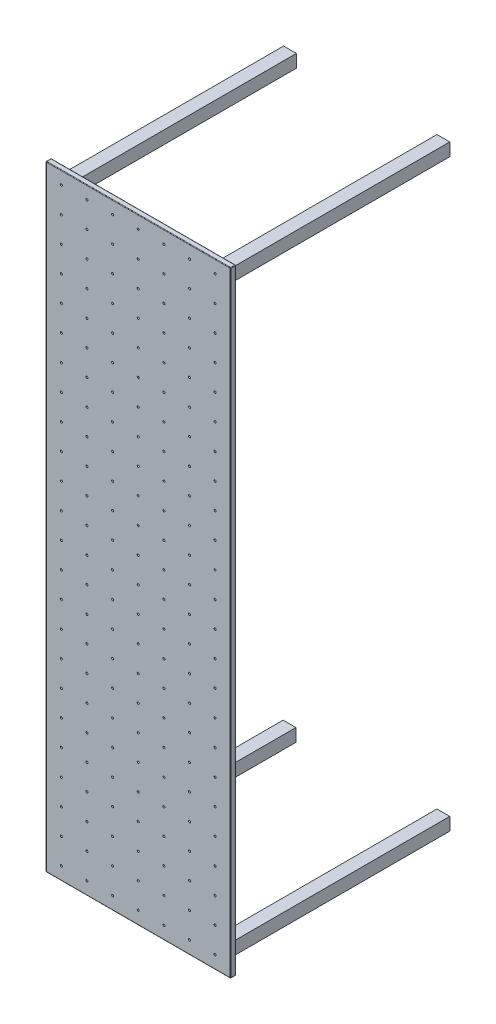
from build123d import *

# Parameters (mm, degrees)
SKETCH1_W           = 720
SKETCH1_H           = 2400
BOSS_EXTRUDE1_DEPTH = 20
SKETCH2_R           = 4
CUT_EXTRUDE1_DEPTH  = 10
FILLET1_R           = 2
SKETCH3_W           = 50
SKETCH3_H           = 50
BOSS_EXTRUDE2_DEPTH = 870


with BuildPart() as part:
    # Sketch1 → Boss-Extrude1 (new body)
    with BuildSketch(Plane.XY):
        Rectangle(SKETCH1_W, SKETCH1_H)
    extrude(amount=BOSS_EXTRUDE1_DEPTH)

    # Sketch2 → Cut-Extrude1 (cut)
    with BuildSketch(Plane.XY.offset(20)):
        with Locations((-300, 1150)):
            Circle(SKETCH2_R)
        with Locations((-200, 1150)):
            Circle(SKETCH2_R)
        with Locations((-100, 1150)):
            Circle(SKETCH2_R)
        with Locations((0, 1150)):
            Circle(SKETCH2_R)
        with Locations((100, 1150)):
            Circle(SKETCH2_R)
        with Locations((200, 1150)):
            Circle(SKETCH2_R)
        with Locations((300, 1150)):
            Circle(SKETCH2_R)
        with Locations((-200, 1050)):
            Circle(SKETCH2_R)
        with Locations((-100, 1050)):
            Circle(SKETCH2_R)
        with Locations((0, 1050)):
            Circle(SKETCH2_R)
        with Locations((100, 1050)):
            Circle(SKETCH2_R)
        with Locations((200, 1050)):
            Circle(SKETCH2_R)
        with Locations((300, 1050)):
            Circle(SKETCH2_R)
        with Locations((-200, 950)):
            Circle(SKETCH2_R)
        with Locations((-100, 950)):
            Circle(SKETCH2_R)
        with Locations((0, 950)):
            Circle(SKETCH2_R)
        with Locations((100, 950)):
            Circle(SKETCH2_R)
        with Locations((200, 950)):
            Circle(SKETCH2_R)
        with Locations((300, 950)):
            Circle(SKETCH2_R)
        with Locations((-200, 850)):
            Circle(SKETCH2_R)
        with Locations((-100, 850)):
            Circle(SKETCH2_R)
        with Locations((0, 850)):
            Circle(SKETCH2_R)
        with Locations((100, 850)):
            Circle(SKETCH2_R)
        with Locations((200, 850)):
            Circle(SKETCH2_R)
        with Locations((300, 850)):
            Circle(SKETCH2_R)
        with Locations((-200, 750)):
            Circle(SKETCH2_R)
        with Locations((-100, 750)):
            Circle(SKETCH2_R)
        with Locations((0, 750)):
            Circle(SKETCH2_R)
        with Locations((100, 750)):
            Circle(SKETCH2_R)
        with Locations((200, 750)):
            Circle(SKETCH2_R)
        with Locations((300, 750)):
            Circle(SKETCH2_R)
        with Locations((-300, 1050)):
            Circle(SKETCH2_R)
        with Locations((-300, 950)):
            Circle(SKETCH2_R)
        with Locations((-300, 850)):
            Circle(SKETCH2_R)
        with Locations((-300, 750)):
            Circle(SKETCH2_R)
        with Locations((-300, 650)):
            Circle(SKETCH2_R)
        with Locations((-300, 550)):
            Circle(SKETCH2_R)
        with Locations((-300, 450)):
            Circle(SKETCH2_R)
        with Locations((-300, 350)):
            Circle(SKETCH2_R)
        with Locations((-300, 250)):
            Circle(SKETCH2_R)
        with Locations((-300, 150)):
            Circle(SKETCH2_R)
        with Locations((-300, 50)):
            Circle(SKETCH2_R)
        with Locations((-300, -50)):
            Circle(SKETCH2_R)
        with Locations((-300, -150)):
            Circle(SKETCH2_R)
        with Locations((-300, -250)):
            Circle(SKETCH2_R)
        with Locations((-300, -350)):
            Circle(SKETCH2_R)
        with Locations((-300, -450)):
            Circle(SKETCH2_R)
        with Locations((-300, -550)):
            Circle(SKETCH2_R)
        with Locations((-300, -650)):
            Circle(SKETCH2_R)
        with Locations((-300, -750)):
            Circle(SKETCH2_R)
        with Locations((-300, -850)):
            Circle(SKETCH2_R)
        with Locations((-300, -950)):
            Circle(SKETCH2_R)
        with Locations((-300, -1050)):
            Circle(SKETCH2_R)
        with Locations((-300, -1150)):
            Circle(SKETCH2_R)
        with Locations((-200, 650)):
            Circle(SKETCH2_R)
        with Locations((-200, 550)):
            Circle(SKETCH2_R)
        with Locations((-200, 450)):
            Circle(SKETCH2_R)
        with Locations((-200, 350)):
            Circle(SKETCH2_R)
        with Locations((-200, 250)):
            Circle(SKETCH2_R)
        with Locations((-200, 150)):
            Circle(SKETCH2_R)
        with Locations((-200, 50)):
            Circle(SKETCH2_R)
        with Locations((-200, -50)):
            Circle(SKETCH2_R)
        with Locations((-200, -150)):
            Circle(SKETCH2_R)
        with Locations((-200, -250)):
            Circle(SKETCH2_R)
        with Locations((-200, -350)):
            Circle(SKETCH2_R)
        with Locations((-200, -450)):
            Circle(SKETCH2_R)
        with Locations((-200, -550)):
            Circle(SKETCH2_R)
        with Locations((-200, -650)):
            Circle(SKETCH2_R)
        with Locations((-200, -750)):
            Circle(SKETCH2_R)
        with Locations((-200, -850)):
            Circle(SKETCH2_R)
        with Locations((-200, -950)):
            Circle(SKETCH2_R)
        with Locations((-200, -1050)):
            Circle(SKETCH2_R)
        with Locations((-200, -1150)):
            Circle(SKETCH2_R)
        with Locations((-100, 650)):
            Circle(SKETCH2_R)
        with Locations((-100, 550)):
            Circle(SKETCH2_R)
        with Locations((-100, 450)):
            Circle(SKETCH2_R)
        with Locations((-100, 350)):
            Circle(SKETCH2_R)
        with Locations((-100, 250)):
            Circle(SKETCH2_R)
        with Locations((-100, 150)):
            Circle(SKETCH2_R)
        with Locations((-100, 50)):
            Circle(SKETCH2_R)
        with Locations((-100, -50)):
            Circle(SKETCH2_R)
        with Locations((-100, -150)):
            Circle(SKETCH2_R)
        with Locations((-100, -250)):
            Circle(SKETCH2_R)
        with Locations((-100, -350)):
            Circle(SKETCH2_R)
        with Locations((-100, -450)):
            Circle(SKETCH2_R)
        with Locations((-100, -550)):
            Circle(SKETCH2_R)
        with Locations((-100, -650)):
            Circle(SKETCH2_R)
        with Locations((-100, -750)):
            Circle(SKETCH2_R)
        with Locations((-100, -850)):
            Circle(SKETCH2_R)
        with Locations((-100, -950)):
            Circle(SKETCH2_R)
        with Locations((-100, -1050)):
            Circle(SKETCH2_R)
        with Locations((-100, -1150)):
            Circle(SKETCH2_R)
        with Locations((0, 650)):
            Circle(SKETCH2_R)
        with Locations((0, 550)):
            Circle(SKETCH2_R)
        with Locations((0, 450)):
            Circle(SKETCH2_R)
        with Locations((0, 350)):
            Circle(SKETCH2_R)
        with Locations((0, 250)):
            Circle(SKETCH2_R)
        with Locations((0, 150)):
            Circle(SKETCH2_R)
        with Locations((0, 50)):
            Circle(SKETCH2_R)
        with Locations((0, -50)):
            Circle(SKETCH2_R)
        with Locations((0, -150)):
            Circle(SKETCH2_R)
        with Locations((0, -250)):
            Circle(SKETCH2_R)
        with Locations((0, -350)):
            Circle(SKETCH2_R)
        with Locations((0, -450)):
            Circle(SKETCH2_R)
        with Locations((0, -550)):
            Circle(SKETCH2_R)
        with Locations((0, -650)):
            Circle(SKETCH2_R)
        with Locations((0, -750)):
            Circle(SKETCH2_R)
        with Locations((0, -850)):
            Circle(SKETCH2_R)
        with Locations((0, -950)):
            Circle(SKETCH2_R)
        with Locations((0, -1050)):
            Circle(SKETCH2_R)
        with Locations((0, -1150)):
            Circle(SKETCH2_R)
        with Locations((100, 650)):
            Circle(SKETCH2_R)
        with Locations((100, 550)):
            Circle(SKETCH2_R)
        with Locations((100, 450)):
            Circle(SKETCH2_R)
        with Locations((100, 350)):
            Circle(SKETCH2_R)
        with Locations((100, 250)):
            Circle(SKETCH2_R)
        with Locations((100, 150)):
            Circle(SKETCH2_R)
        with Locations((100, 50)):
            Circle(SKETCH2_R)
        with Locations((100, -50)):
            Circle(SKETCH2_R)
        with Locations((100, -150)):
            Circle(SKETCH2_R)
        with Locations((100, -250)):
            Circle(SKETCH2_R)
        with Locations((100, -350)):
            Circle(SKETCH2_R)
        with Locations((100, -450)):
            Circle(SKETCH2_R)
        with Locations((100, -550)):
            Circle(SKETCH2_R)
        with Locations((100, -650)):
            Circle(SKETCH2_R)
        with Locations((100, -750)):
            Circle(SKETCH2_R)
        with Locations((100, -850)):
            Circle(SKETCH2_R)
        with Locations((100, -950)):
            Circle(SKETCH2_R)
        with Locations((100, -1050)):
            Circle(SKETCH2_R)
        with Locations((100, -1150)):
            Circle(SKETCH2_R)
        with Locations((200, 650)):
            Circle(SKETCH2_R)
        with Locations((200, 550)):
            Circle(SKETCH2_R)
        with Locations((200, 450)):
            Circle(SKETCH2_R)
        with Locations((200, 350)):
            Circle(SKETCH2_R)
        with Locations((200, 250)):
            Circle(SKETCH2_R)
        with Locations((200, 150)):
            Circle(SKETCH2_R)
        with Locations((200, 50)):
            Circle(SKETCH2_R)
        with Locations((200, -50)):
            Circle(SKETCH2_R)
        with Locations((200, -150)):
            Circle(SKETCH2_R)
        with Locations((200, -250)):
            Circle(SKETCH2_R)
        with Locations((200, -350)):
            Circle(SKETCH2_R)
        with Locations((200, -450)):
            Circle(SKETCH2_R)
        with Locations((200, -550)):
            Circle(SKETCH2_R)
        with Locations((200, -650)):
            Circle(SKETCH2_R)
        with Locations((200, -750)):
            Circle(SKETCH2_R)
        with Locations((200, -850)):
            Circle(SKETCH2_R)
        with Locations((200, -950)):
            Circle(SKETCH2_R)
        with Locations((200, -1050)):
            Circle(SKETCH2_R)
        with Locations((200, -1150)):
            Circle(SKETCH2_R)
        with Locations((300, 650)):
            Circle(SKETCH2_R)
        with Locations((300, 550)):
            Circle(SKETCH2_R)
        with Locations((300, 450)):
            Circle(SKETCH2_R)
        with Locations((300, 350)):
            Circle(SKETCH2_R)
        with Locations((300, 250)):
            Circle(SKETCH2_R)
        with Locations((300, 150)):
            Circle(SKETCH2_R)
        with Locations((300, 50)):
            Circle(SKETCH2_R)
        with Locations((300, -50)):
            Circle(SKETCH2_R)
        with Locations((300, -150)):
            Circle(SKETCH2_R)
        with Locations((300, -250)):
            Circle(SKETCH2_R)
        with Locations((300, -350)):
            Circle(SKETCH2_R)
        with Locations((300, -450)):
            Circle(SKETCH2_R)
        with Locations((300, -550)):
            Circle(SKETCH2_R)
        with Locations((300, -650)):
            Circle(SKETCH2_R)
        with Locations((300, -750)):
            Circle(SKETCH2_R)
        with Locations((300, -850)):
            Circle(SKETCH2_R)
        with Locations((300, -950)):
            Circle(SKETCH2_R)
        with Locations((300, -1050)):
            Circle(SKETCH2_R)
        with Locations((300, -1150)):
            Circle(SKETCH2_R)
    extrude(amount=-CUT_EXTRUDE1_DEPTH, mode=Mode.SUBTRACT)

    # Fillet1
    fillet1_edges = [part.edges().sort_by_distance(p)[0] for p in [
        (360, 0, 20),
        (0, 1200, 20),
        (-360, 0, 20),
        (0, 1200, 0),
        (360, 0, 0),
        (0, -1200, 0),
        (-360, 0, 0),
        (-360, 1200, 10),
        (360, 1200, 10),
        (360, -1200, 10),
        (-360, -1200, 10),
        (0, -1200, 20),
    ]]
    fillet(fillet1_edges, radius=FILLET1_R)

    # Sketch3 → Boss-Extrude2 (add)
    with BuildSketch(Plane(origin=(0, 0, 0), x_dir=(-1, 0, 0), z_dir=(0, 0, -1))):
        with Locations((-300, 1138)):
            Rectangle(SKETCH3_W, SKETCH3_H)
        with Locations((298, 1138)):
            Rectangle(SKETCH3_W, SKETCH3_H)
        with Locations((300, -1140)):
            Rectangle(SKETCH3_W, SKETCH3_H)
        with Locations((-300, -1140)):
            Rectangle(SKETCH3_W, SKETCH3_H)
    extrude(amount=BOSS_EXTRUDE2_DEPTH)


solid = part.part
